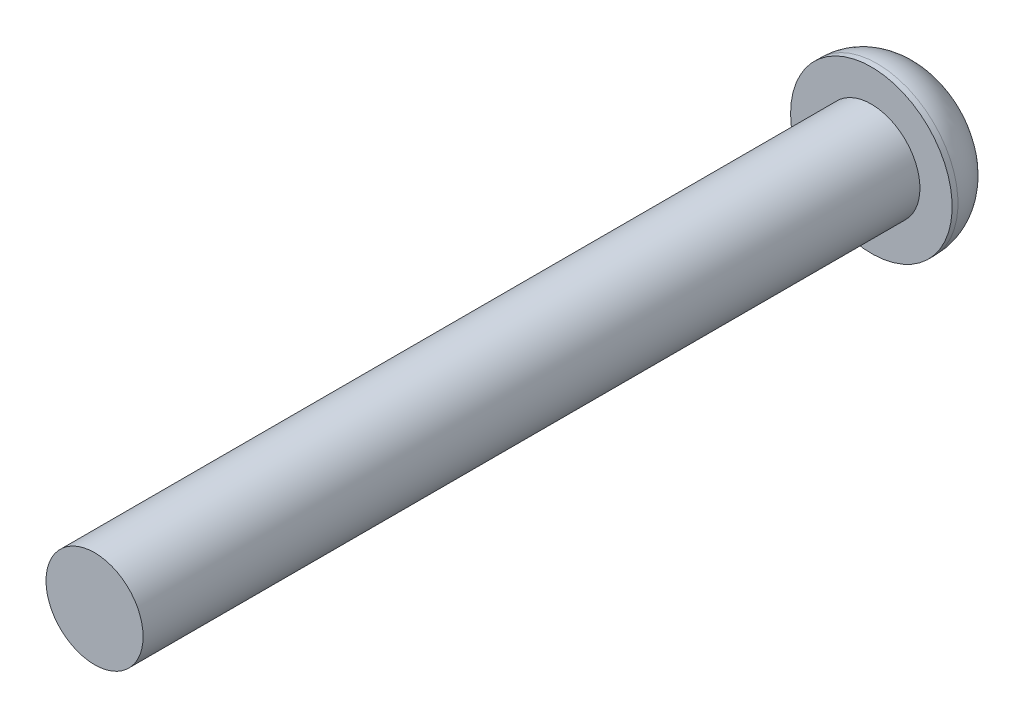
from build123d import *

# Parameters (mm, degrees)
SKETCH1_R           = 2.5
BOSS_EXTRUDE1_DEPTH = 40
SKETCH2_R           = 4.159584877
BOSS_EXTRUDE2_DEPTH = 2.8
FILLET1_R           = 2.5
CUT_EXTRUDE1_DEPTH  = 2


with BuildPart() as part:
    # Sketch1 → Boss-Extrude1 (new body)
    with BuildSketch(Plane.XY):
        Circle(SKETCH1_R)
    extrude(amount=BOSS_EXTRUDE1_DEPTH)

    # Sketch2 → Boss-Extrude2 (add)
    with BuildSketch(Plane(origin=(0, 0, 0), x_dir=(-1, 0, 0), z_dir=(0, 0, -1))):
        Circle(SKETCH2_R)
    extrude(amount=BOSS_EXTRUDE2_DEPTH)

    # Fillet1
    fillet1_edges = [part.edges().sort_by_distance(p)[0] for p in [
        (4.159584877, 0, -2.8),
    ]]
    fillet(fillet1_edges, radius=FILLET1_R)

    # Sketch3 → Cut-Extrude1 (cut)
    with BuildSketch(Plane(origin=(0, 0, -2.8), x_dir=(-1, 0, 0), z_dir=(0, 0, -1))):
        Polygon((1.392434699, -0.636521364), (1.247461021, 0.88762314), (-0.144973678, 1.524144504), (-1.392434699, 0.636521364), (-1.247461021, -0.88762314), (0.144973678, -1.524144504), align=None)
    extrude(amount=-CUT_EXTRUDE1_DEPTH, mode=Mode.SUBTRACT)


solid = part.part
